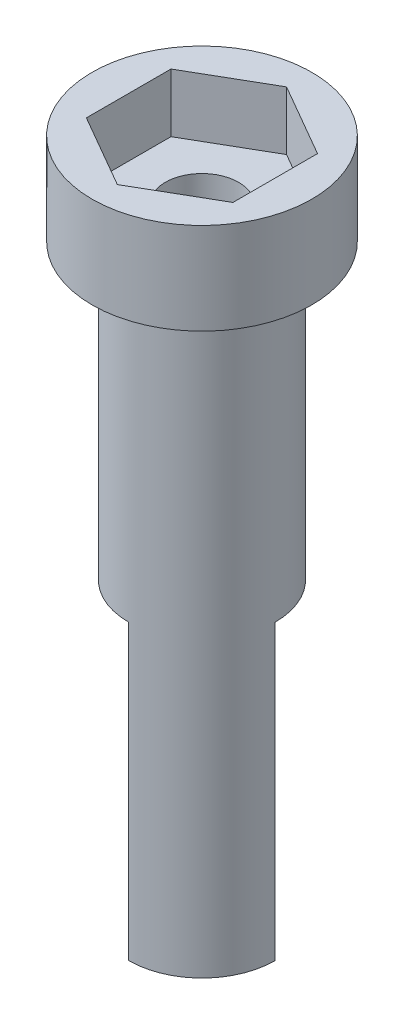
from build123d import *

# Parameters (mm, degrees)
SKETCH_1_R          = 2
SKETCH_1_R_2        = 1
EXTRUDE_1_DEPTH     = 29
SKETCH_2_R          = 3
SKETCH_2_R_2        = 2
EXTRUDE_2_DEPTH     = 2.5
EXTRUDE_START       = 26.5
SKETCH_3_R          = 3
SKETCH_3_R_2        = 2
EXTRUDE_3_DEPTH     = 2.5
SKETCH_4_R          = 1.6
CUT_EXTRUDE_1_DEPTH = 1.5
CUT_EXTRUDE_START   = 29
CUT_EXTRUDE_2_DEPTH = 1.6
SKETCH_7_R          = 3
CUT_EXTRUDE_3_DEPTH = 10.5
CUT_EXTRUDE_START_2 = 10.5
CUT_EXTRUDE_4_DEPTH = 8


with BuildPart() as part:
    # 草图1 → 凸台-拉伸1 (new body)
    with BuildSketch(Plane(origin=(0, 0, 0), x_dir=(1, 0, 0), z_dir=(0, 1, 0))):
        with Locations(Location((0, 0, 0), (0, 0, 90))):
            Circle(SKETCH_1_R)
        with Locations(Location((0, 0, 0), (0, 0, 90))):
            Circle(SKETCH_1_R_2, mode=Mode.SUBTRACT)
    extrude(amount=EXTRUDE_1_DEPTH)

    # 草图2 → 凸台-拉伸2 (add)
    with BuildSketch(Plane(origin=(0, 0, 0), x_dir=(1, 0, 0), z_dir=(0, 1, 0))):
        with Locations(Location((0, 0, 0), (0, 0, 270))):
            Circle(SKETCH_2_R)
        with Locations(Location((0, 0, 0), (0, 0, 90))):
            Circle(SKETCH_2_R_2, mode=Mode.SUBTRACT)
    extrude(amount=EXTRUDE_2_DEPTH)

    # 草图3 → 凸台-拉伸3 (add)
    with BuildSketch(Plane(origin=(0, 0, 0), x_dir=(1, 0, 0), z_dir=(0, 1, 0)).offset(EXTRUDE_START)):
        with Locations(Location((0, 0, 0), (0, 0, 270))):
            Circle(SKETCH_3_R)
        with Locations(Location((0, 0, 0), (0, 0, 90))):
            Circle(SKETCH_3_R_2, mode=Mode.SUBTRACT)
    extrude(amount=EXTRUDE_3_DEPTH)

    # 草图4 → 切除-拉伸1 (cut)
    with BuildSketch(Plane(origin=(0, 0, 0), x_dir=(1, 0, 0), z_dir=(0, 1, 0))):
        with Locations(Location((0, 0, 0), (0, 0, 270))):
            Circle(SKETCH_4_R)
    extrude(amount=CUT_EXTRUDE_1_DEPTH, mode=Mode.SUBTRACT)

    # 草图5 → 切除-拉伸2 (cut)
    with BuildSketch(Plane(origin=(0, 0, 0), x_dir=(1, 0, 0), z_dir=(0, 1, 0)).offset(CUT_EXTRUDE_START)):
        Polygon((0, -2.309401077), (2, -1.154700538), (2, 1.154700538), (0, 2.309401077), (-2, 1.154700538), (-2, -1.154700538), align=None)
    extrude(amount=-CUT_EXTRUDE_2_DEPTH, mode=Mode.SUBTRACT)

    # 草图7 → 切除-拉伸3 (cut)
    with BuildSketch(Plane(origin=(0, 0, 0), x_dir=(1, 0, 0), z_dir=(0, 1, 0))):
        with Locations(Location((0, 0, 0), (0, 0, 270))):
            Circle(SKETCH_7_R)
    extrude(amount=CUT_EXTRUDE_3_DEPTH, mode=Mode.SUBTRACT)

    # 草图8 → 切除-拉伸4 (cut)
    with BuildSketch(Plane(origin=(0, 0, 0), x_dir=(1, 0, 0), z_dir=(0, 1, 0)).offset(CUT_EXTRUDE_START_2)):
        with BuildLine():
            Line((0, 0), (2, 0))
            ThreePointArc((2, 0), (1.414213562, 1.414213562), (0, 2))
            Line((0, 2), (0, 0))
        make_face()
        with BuildLine():
            Line((0, -2), (0, 0))
            Line((0, 0), (-2, 0))
            ThreePointArc((-2, 0), (-1.414213562, -1.414213562), (0, -2))
        make_face()
    extrude(amount=CUT_EXTRUDE_4_DEPTH, mode=Mode.SUBTRACT)


solid = part.part
